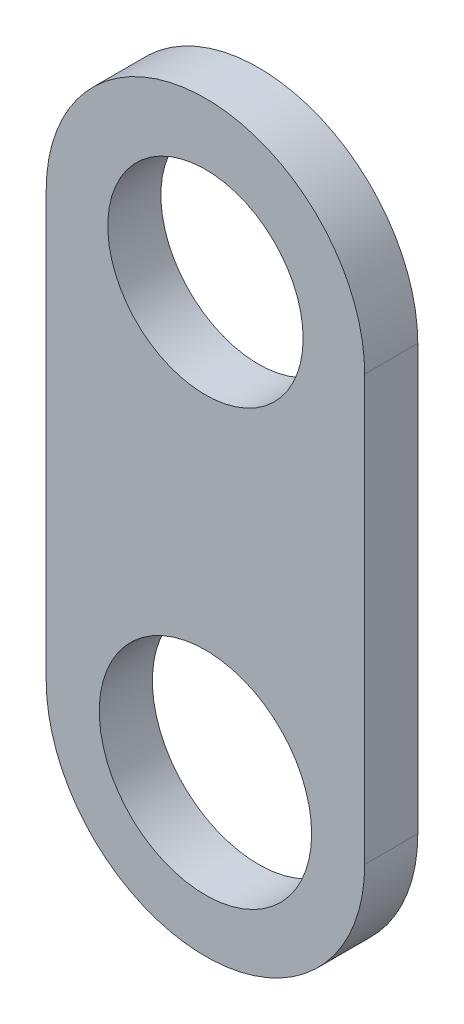
from build123d import *

# Parameters (mm, degrees)
SKETCH1_R           = 11.684
SKETCH1_R_2         = 12.7
BOSS_EXTRUDE1_DEPTH = 6.35


with BuildPart() as part:
    # Sketch1 → Boss-Extrude1 (new body)
    with BuildSketch(Plane.XY):
        with BuildLine():
            Line((0, 34.187719096), (0, -16.612280904))
            ThreePointArc((0, -16.612280904), (19.05, -35.662280904), (38.1, -16.612280904))
            Line((38.1, -16.612280904), (38.1, 34.187719096))
            ThreePointArc((38.1, 34.187719096), (19.05, 53.237719096), (0, 34.187719096))
        make_face()
        with Locations((19.05, 34.187719096)):
            Circle(SKETCH1_R, mode=Mode.SUBTRACT)
        with Locations((19.05, -16.612280904)):
            Circle(SKETCH1_R_2, mode=Mode.SUBTRACT)
    extrude(amount=BOSS_EXTRUDE1_DEPTH)


solid = part.part
